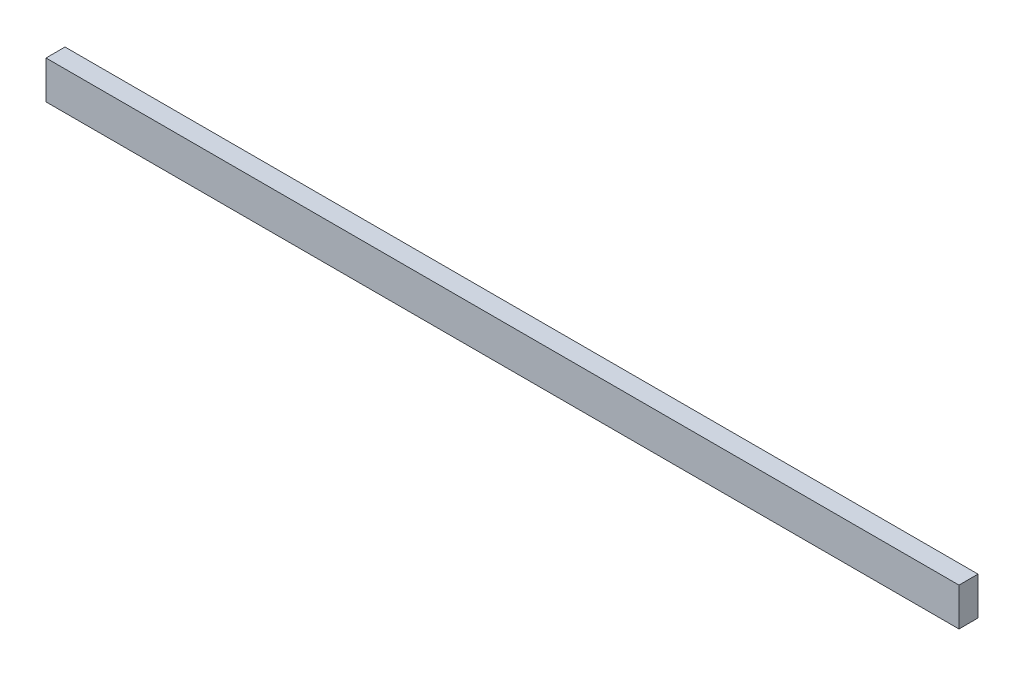
from build123d import *

# Parameters (mm, degrees)
SKETCH1_W           = 2438.4
SKETCH1_H           = 101.6
BOSS_EXTRUDE1_DEPTH = 50.8


with BuildPart() as part:
    # Sketch1 → Boss-Extrude1 (new body)
    with BuildSketch(Plane.XY):
        Rectangle(SKETCH1_W, SKETCH1_H)
    extrude(amount=BOSS_EXTRUDE1_DEPTH)


solid = part.part
